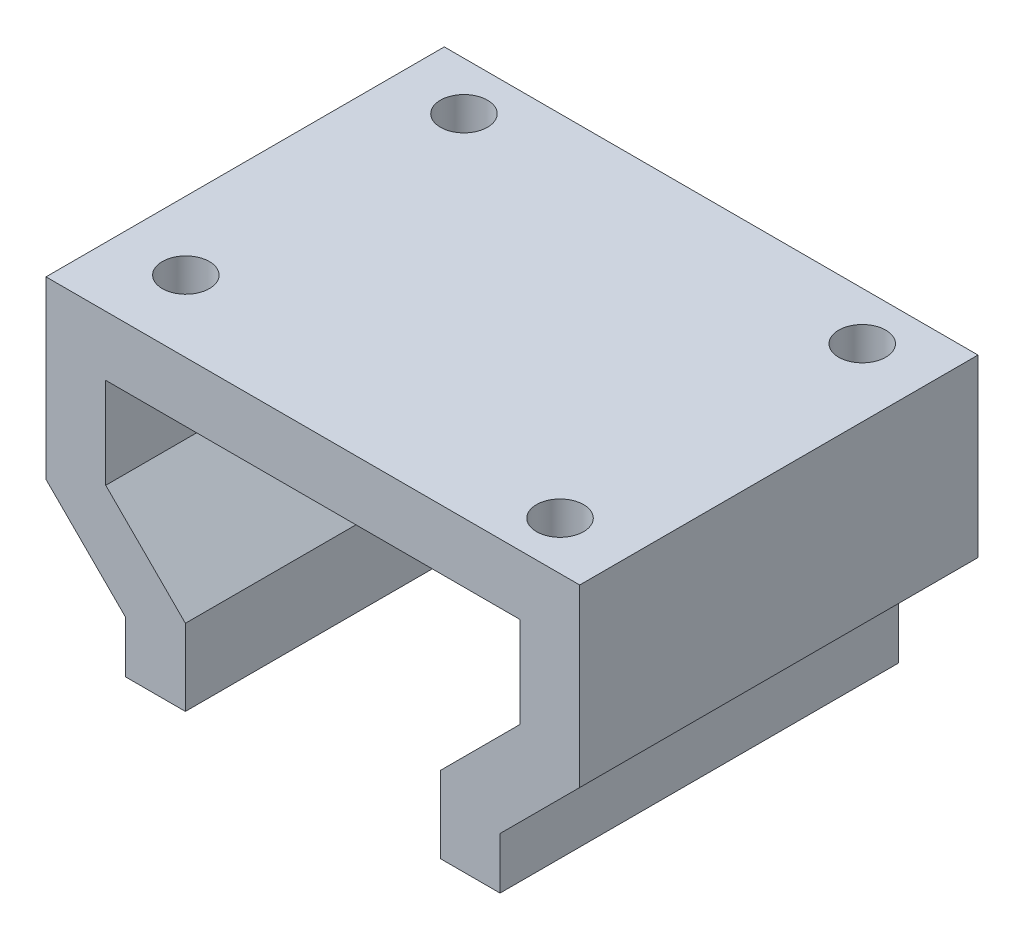
from build123d import *

# Parameters (mm, degrees)
BOSS_EXTRUDE1_DEPTH = 25.4
SKETCH2_R           = 1.5
CUT_EXTRUDE1_DEPTH  = 3.81


with BuildPart() as part:
    # Sketch1 → Boss-Extrude1 (new body)
    with BuildSketch(Plane.XY):
        Polygon((-13.208, 13.208), (13.208, 13.208), (13.208, 7.40957951), (8.128, 2.32957951), (8.128, -2.54), (11.938, -2.54), (11.938, 0.751425838), (17.018, 5.831425838), (17.018, 17.018), (-17.018, 17.018), (-17.018, 5.831425838), (-11.938, 0.751425838), (-11.938, -2.54), (-8.128, -2.54), (-8.128, 2.32957951), (-13.208, 7.40957951), align=None)
    extrude(amount=BOSS_EXTRUDE1_DEPTH)

    # Sketch2 → Cut-Extrude1 (cut)
    with BuildSketch(Plane(origin=(0, 17.018, 0), x_dir=(1, 0, 0), z_dir=(0, 1, 0))):
        with Locations(Location((-12.7, -3.06402769, 0), (0, 0, 270))):
            Circle(SKETCH2_R)
        with Locations(Location((-12.656142054, -20.843973598, 0), (0, 0, 270))):
            Circle(SKETCH2_R)
        with Locations(Location((12.7, -22.33597231, 0), (0, 0, 270))):
            Circle(SKETCH2_R)
        with Locations(Location((12.7, -3.06402769, 0), (0, 0, 270))):
            Circle(SKETCH2_R)
    extrude(amount=-CUT_EXTRUDE1_DEPTH, mode=Mode.SUBTRACT)


solid = part.part
